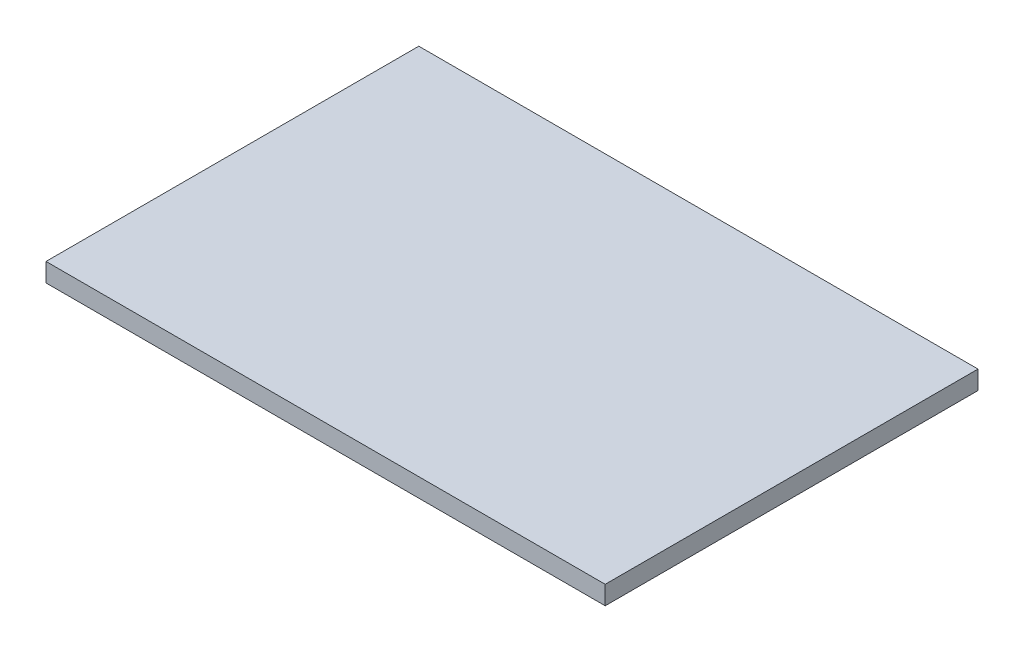
from build123d import *

# Parameters (mm, degrees)
SKETCH1_W           = 150
SKETCH1_H           = 100
BOSS_EXTRUDE1_DEPTH = 5


with BuildPart() as part:
    # Sketch1 → Boss-Extrude1 (new body)
    with BuildSketch(Plane(origin=(0, 0, 0), x_dir=(1, 0, 0), z_dir=(0, 1, 0))):
        Rectangle(SKETCH1_W, SKETCH1_H)
    extrude(amount=BOSS_EXTRUDE1_DEPTH)


solid = part.part
